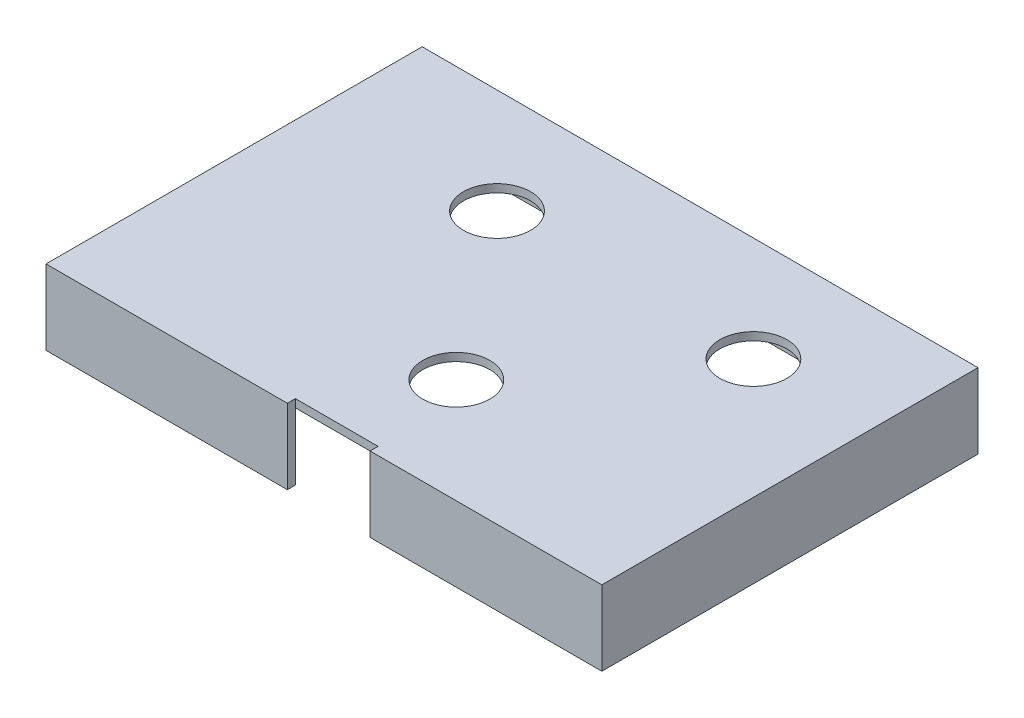
from build123d import *

# Parameters (mm, degrees)
SKETCH1_W           = 235.712
SKETCH1_H           = 159.512
BOSS_EXTRUDE1_DEPTH = 31.75
SKETCH2_W           = 228.9048
SKETCH2_H           = 152.7048
CUT_EXTRUDE1_DEPTH  = 28.3464
SKETCH3_W           = 35.052
SKETCH3_H           = 3.4036
CUT_EXTRUDE2_DEPTH  = 287.377875521
SKETCH4_R           = 14.224
CUT_EXTRUDE3_DEPTH  = 287.377875521


with BuildPart() as part:
    # Sketch1 → Boss-Extrude1 (new body)
    with BuildSketch(Plane(origin=(0, 0, 0), x_dir=(1, 0, 0), z_dir=(0, 1, 0))):
        with Locations((117.856, 79.756)):
            Rectangle(SKETCH1_W, SKETCH1_H)
    extrude(amount=BOSS_EXTRUDE1_DEPTH)

    # Sketch2 → Cut-Extrude1 (cut)
    with BuildSketch(Plane.XZ):
        with Locations((117.856, -79.756)):
            Rectangle(SKETCH2_W, SKETCH2_H)
    extrude(amount=-CUT_EXTRUDE1_DEPTH, mode=Mode.SUBTRACT)

    # Sketch3 → Cut-Extrude2 (cut, through all)
    with BuildSketch(Plane(origin=(0, 31.75, 0), x_dir=(1, 0, 0), z_dir=(0, 1, 0))):
        with Locations((119.888, 1.7018)):
            Rectangle(SKETCH3_W, SKETCH3_H)
    extrude(amount=-CUT_EXTRUDE2_DEPTH, mode=Mode.SUBTRACT)

    # Sketch4 → Cut-Extrude3 (cut, through all)
    with BuildSketch(Plane(origin=(0, 31.75, 0), x_dir=(1, 0, 0), z_dir=(0, 1, 0))):
        with Locations(Location((76.2, 115.062, 0), (0, 0, 270))):
            Circle(SKETCH4_R)
        with Locations(Location((129.54, 44.45, 0), (0, 0, 270))):
            Circle(SKETCH4_R)
        with Locations(Location((184.912, 115.062, 0), (0, 0, 270))):
            Circle(SKETCH4_R)
    extrude(amount=-CUT_EXTRUDE3_DEPTH, mode=Mode.SUBTRACT)


solid = part.part
